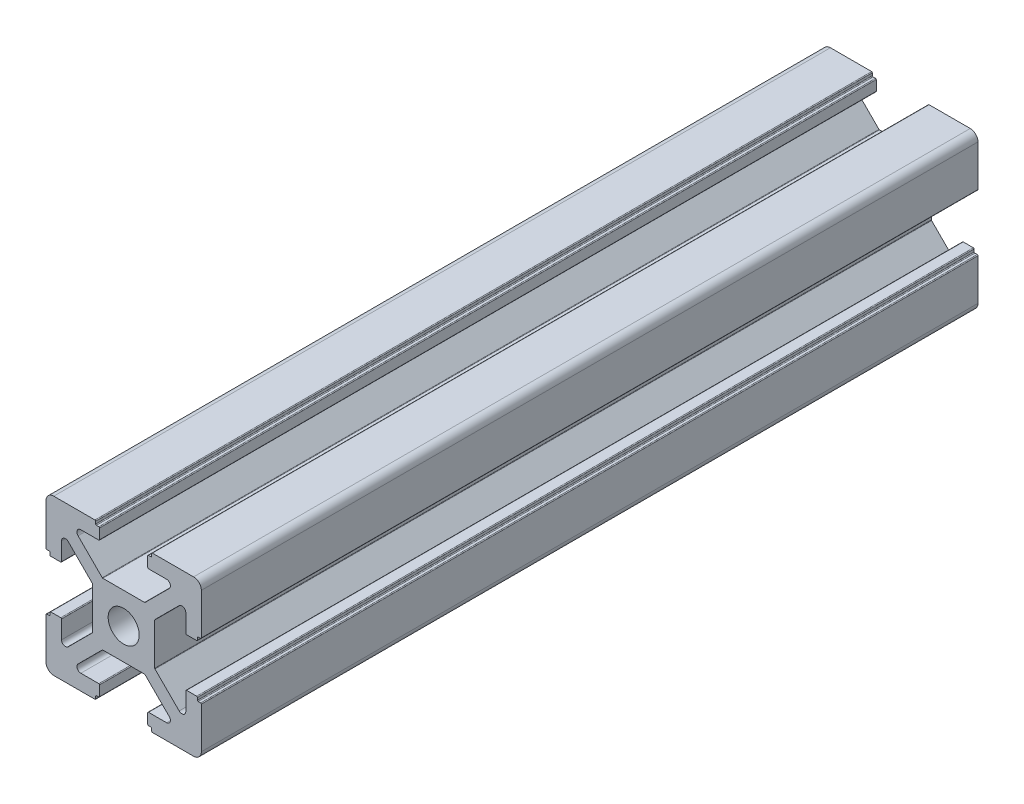
from build123d import *

# Parameters (mm, degrees)
SKETCH1_R           = 2
BOSS_EXTRUDE1_DEPTH = 100


with BuildPart() as part:
    # Sketch1 → Boss-Extrude1 (new body)
    with BuildSketch(Plane.XY):
        with BuildLine():
            Line((-10, 9), (-10, 3.7))
            ThreePointArc((-10, 3.7), (-9.970710678, 3.629289322), (-9.9, 3.6))
            Line((-9.9, 3.6), (-9.6, 3.6))
            ThreePointArc((-9.6, 3.6), (-9.529289322, 3.570710678), (-9.5, 3.5))
            Line((-9.5, 3.5), (-9.5, 3.2))
            ThreePointArc((-9.5, 3.2), (-9.470710678, 3.129289322), (-9.4, 3.1))
            Line((-9.4, 3.1), (-8.1, 3.1))
            ThreePointArc((-8.1, 3.1), (-8.029289322, 3.129289322), (-8, 3.2))
            Line((-8, 3.2), (-8, 5.520101013))
            ThreePointArc((-8, 5.520101013), (-7.691341716, 5.982040779), (-7.146446609, 5.873654403))
            Line((-7.146446609, 5.873654403), (-4.029289322, 2.756497116))
            ThreePointArc((-4.029289322, 2.756497116), (-4.007612047, 2.724054781), (-4, 2.685786438))
            Line((-4, 2.685786438), (-4, 0))
            Line((-4, 0), (-4, -2.685786438))
            ThreePointArc((-4, -2.685786438), (-4.007612047, -2.724054781), (-4.029289322, -2.756497116))
            Line((-4.029289322, -2.756497116), (-7.146446609, -5.873654403))
            ThreePointArc((-7.146446609, -5.873654403), (-7.691341716, -5.982040779), (-8, -5.520101013))
            Line((-8, -5.520101013), (-8, -3.2))
            ThreePointArc((-8, -3.2), (-8.029289322, -3.129289322), (-8.1, -3.1))
            Line((-8.1, -3.1), (-9.4, -3.1))
            ThreePointArc((-9.4, -3.1), (-9.470710678, -3.129289322), (-9.5, -3.2))
            Line((-9.5, -3.2), (-9.5, -3.5))
            ThreePointArc((-9.5, -3.5), (-9.529289322, -3.570710678), (-9.6, -3.6))
            Line((-9.6, -3.6), (-9.9, -3.6))
            ThreePointArc((-9.9, -3.6), (-9.970710678, -3.629289322), (-10, -3.7))
            Line((-10, -3.7), (-10, -9))
            ThreePointArc((-10, -9), (-9.707106781, -9.707106781), (-9, -10))
            Line((-9, -10), (-3.7, -10))
            ThreePointArc((-3.7, -10), (-3.629289322, -9.970710678), (-3.6, -9.9))
            Line((-3.6, -9.9), (-3.6, -9.6))
            ThreePointArc((-3.6, -9.6), (-3.570710678, -9.529289322), (-3.5, -9.5))
            Line((-3.5, -9.5), (-3.2, -9.5))
            ThreePointArc((-3.2, -9.5), (-3.129289322, -9.470710678), (-3.1, -9.4))
            Line((-3.1, -9.4), (-3.1, -8.1))
            ThreePointArc((-3.1, -8.1), (-3.129289322, -8.029289322), (-3.2, -8))
            Line((-3.2, -8), (-5.520101013, -8))
            ThreePointArc((-5.520101013, -8), (-5.982040779, -7.691341716), (-5.873654403, -7.146446609))
            Line((-5.873654403, -7.146446609), (-2.756497116, -4.029289322))
            ThreePointArc((-2.756497116, -4.029289322), (-2.724054781, -4.007612047), (-2.685786438, -4))
            Line((-2.685786438, -4), (2.685786438, -4))
            ThreePointArc((2.685786438, -4), (2.724054781, -4.007612047), (2.756497116, -4.029289322))
            Line((2.756497116, -4.029289322), (5.873654403, -7.146446609))
            ThreePointArc((5.873654403, -7.146446609), (5.982040779, -7.691341716), (5.520101013, -8))
            Line((5.520101013, -8), (3.2, -8))
            ThreePointArc((3.2, -8), (3.129289322, -8.029289322), (3.1, -8.1))
            Line((3.1, -8.1), (3.1, -9.4))
            ThreePointArc((3.1, -9.4), (3.129289322, -9.470710678), (3.2, -9.5))
            Line((3.2, -9.5), (3.5, -9.5))
            ThreePointArc((3.5, -9.5), (3.570710678, -9.529289322), (3.6, -9.6))
            Line((3.6, -9.6), (3.6, -9.9))
            ThreePointArc((3.6, -9.9), (3.629289322, -9.970710678), (3.7, -10))
            Line((3.7, -10), (9, -10))
            ThreePointArc((9, -10), (9.707106781, -9.707106781), (10, -9))
            Line((10, -9), (10, -3.7))
            ThreePointArc((10, -3.7), (9.970710678, -3.629289322), (9.9, -3.6))
            Line((9.9, -3.6), (9.6, -3.6))
            ThreePointArc((9.6, -3.6), (9.529289322, -3.570710678), (9.5, -3.5))
            Line((9.5, -3.5), (9.5, -3.2))
            ThreePointArc((9.5, -3.2), (9.470710678, -3.129289322), (9.4, -3.1))
            Line((9.4, -3.1), (8.1, -3.1))
            ThreePointArc((8.1, -3.1), (8.029289322, -3.129289322), (8, -3.2))
            Line((8, -3.2), (8, -5.520101013))
            ThreePointArc((8, -5.520101013), (7.691341716, -5.982040779), (7.146446609, -5.873654403))
            Line((7.146446609, -5.873654403), (4.029289322, -2.756497116))
            ThreePointArc((4.029289322, -2.756497116), (4.007612047, -2.724054781), (4, -2.685786438))
            Line((4, -2.685786438), (4, 0))
            Line((4, 0), (4, 2.685786438))
            ThreePointArc((4, 2.685786438), (4.007612047, 2.724054781), (4.029289322, 2.756497116))
            Line((4.029289322, 2.756497116), (7.146446609, 5.873654403))
            ThreePointArc((7.146446609, 5.873654403), (7.691341716, 5.982040779), (8, 5.520101013))
            Line((8, 5.520101013), (8, 3.2))
            ThreePointArc((8, 3.2), (8.029289322, 3.129289322), (8.1, 3.1))
            Line((8.1, 3.1), (9.4, 3.1))
            ThreePointArc((9.4, 3.1), (9.470710678, 3.129289322), (9.5, 3.2))
            Line((9.5, 3.2), (9.5, 3.5))
            ThreePointArc((9.5, 3.5), (9.529289322, 3.570710678), (9.6, 3.6))
            Line((9.6, 3.6), (9.9, 3.6))
            ThreePointArc((9.9, 3.6), (9.970710678, 3.629289322), (10, 3.7))
            Line((10, 3.7), (10, 9))
            ThreePointArc((10, 9), (9.707106781, 9.707106781), (9, 10))
            Line((9, 10), (3.7, 10))
            ThreePointArc((3.7, 10), (3.629289322, 9.970710678), (3.6, 9.9))
            Line((3.6, 9.9), (3.6, 9.6))
            ThreePointArc((3.6, 9.6), (3.570710678, 9.529289322), (3.5, 9.5))
            Line((3.5, 9.5), (3.2, 9.5))
            ThreePointArc((3.2, 9.5), (3.129289322, 9.470710678), (3.1, 9.4))
            Line((3.1, 9.4), (3.1, 8.1))
            ThreePointArc((3.1, 8.1), (3.129289322, 8.029289322), (3.2, 8))
            Line((3.2, 8), (5.520101013, 8))
            ThreePointArc((5.520101013, 8), (5.982040779, 7.691341716), (5.873654403, 7.146446609))
            Line((5.873654403, 7.146446609), (2.756497116, 4.029289322))
            ThreePointArc((2.756497116, 4.029289322), (2.724054781, 4.007612047), (2.685786438, 4))
            Line((2.685786438, 4), (-2.685786438, 4))
            ThreePointArc((-2.685786438, 4), (-2.724054781, 4.007612047), (-2.756497116, 4.029289322))
            Line((-2.756497116, 4.029289322), (-5.873654403, 7.146446609))
            ThreePointArc((-5.873654403, 7.146446609), (-5.982040779, 7.691341716), (-5.520101013, 8))
            Line((-5.520101013, 8), (-3.2, 8))
            ThreePointArc((-3.2, 8), (-3.129289322, 8.029289322), (-3.1, 8.1))
            Line((-3.1, 8.1), (-3.1, 9.4))
            ThreePointArc((-3.1, 9.4), (-3.129289322, 9.470710678), (-3.2, 9.5))
            Line((-3.2, 9.5), (-3.5, 9.5))
            ThreePointArc((-3.5, 9.5), (-3.570710678, 9.529289322), (-3.6, 9.6))
            Line((-3.6, 9.6), (-3.6, 9.9))
            ThreePointArc((-3.6, 9.9), (-3.629289322, 9.970710678), (-3.7, 10))
            Line((-3.7, 10), (-9, 10))
            ThreePointArc((-9, 10), (-9.707106781, 9.707106781), (-10, 9))
        make_face()
        Circle(SKETCH1_R, mode=Mode.SUBTRACT)
    extrude(amount=BOSS_EXTRUDE1_DEPTH)


solid = part.part
